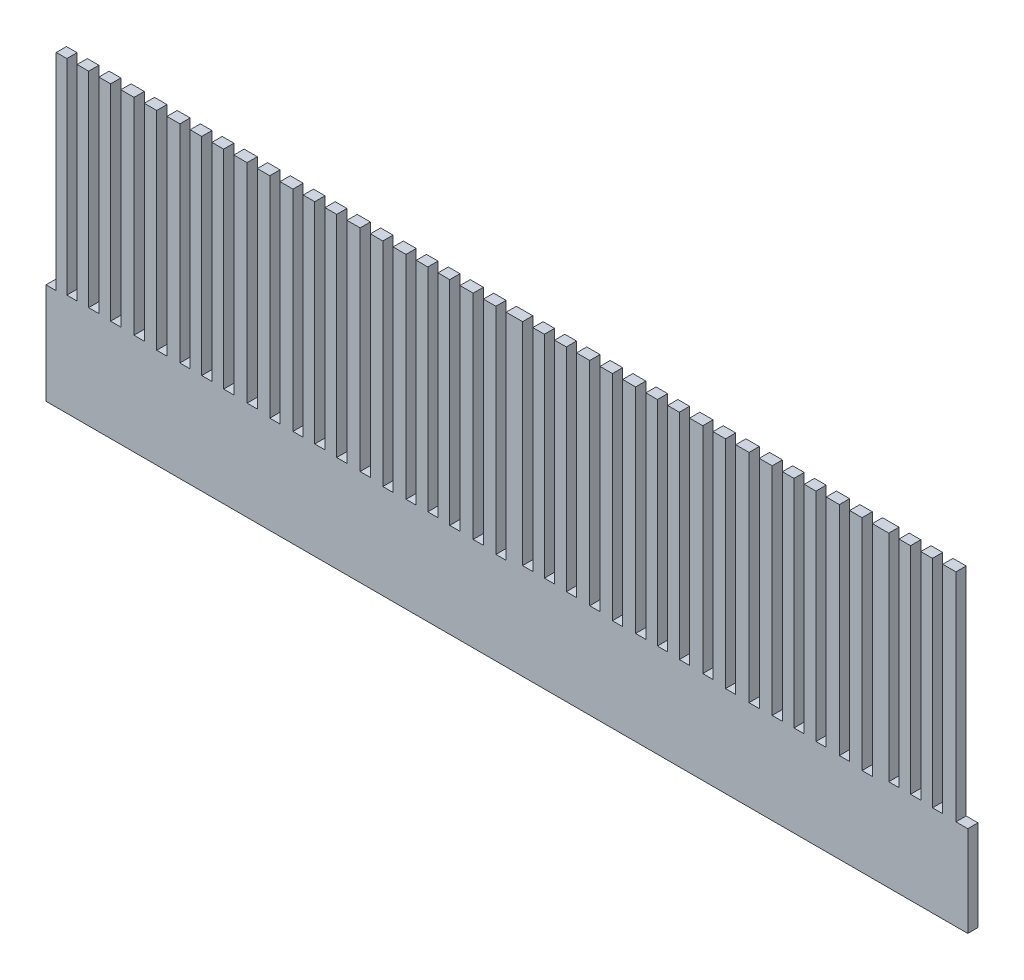
from build123d import *

# Parameters (mm, degrees)
SKETCH1_W           = 45
SKETCH1_H           = 15
BOSS_EXTRUDE1_DEPTH = 0.5
SKETCH2_W           = 0.5
SKETCH2_H           = 12
SKETCH2_H_2         = 10.074487737
SKETCH2_W_2         = 0.812235623
CUT_EXTRUDE1_DEPTH  = 0.5


with BuildPart() as part:
    # Sketch1 → Boss-Extrude1 (new body)
    with BuildSketch(Plane.XY):
        with Locations((-31.419252999, 7.5)):
            Rectangle(SKETCH1_W, SKETCH1_H)
    extrude(amount=BOSS_EXTRUDE1_DEPTH)

    # Sketch2 → Cut-Extrude1 (cut)
    with BuildSketch(Plane.XY.offset(0.5)):
        with Locations((-52.65136316, 10.998562855)):
            Rectangle(SKETCH2_W, SKETCH2_H)
        with Locations((-53.669252999, 9.962756132)):
            Rectangle(SKETCH2_W, SKETCH2_H_2)
        with Locations((-51.587300045, 11.000260257)):
            Rectangle(SKETCH2_W, SKETCH2_H)
        with Locations((-50.51602115, 10.963702729)):
            Rectangle(SKETCH2_W, SKETCH2_H)
        with Locations((-49.371583394, 10.941885768)):
            Rectangle(SKETCH2_W, SKETCH2_H)
        with Locations((-48.263902197, 10.86130862)):
            Rectangle(SKETCH2_W, SKETCH2_H)
        with Locations((-47.132506134, 10.88799725)):
            Rectangle(SKETCH2_W, SKETCH2_H)
        with Locations((-46.068443018, 10.889694652)):
            Rectangle(SKETCH2_W, SKETCH2_H)
        with Locations((-44.997164124, 10.853137125)):
            Rectangle(SKETCH2_W, SKETCH2_H)
        with Locations((-43.852726367, 10.831320164)):
            Rectangle(SKETCH2_W, SKETCH2_H)
        with Locations((-42.745045171, 10.750743016)):
            Rectangle(SKETCH2_W, SKETCH2_H)
        with Locations((-41.613016052, 10.755156249)):
            Rectangle(SKETCH2_W, SKETCH2_H)
        with Locations((-40.548952936, 10.756853651)):
            Rectangle(SKETCH2_W, SKETCH2_H)
        with Locations((-39.477674042, 10.720296123)):
            Rectangle(SKETCH2_W, SKETCH2_H)
        with Locations((-38.333236285, 10.698479162)):
            Rectangle(SKETCH2_W, SKETCH2_H)
        with Locations((-37.225555089, 10.617902014)):
            Rectangle(SKETCH2_W, SKETCH2_H)
        with Locations((-36.094159026, 10.644590644)):
            Rectangle(SKETCH2_W, SKETCH2_H)
        with Locations((-35.03009591, 10.646288046)):
            Rectangle(SKETCH2_W, SKETCH2_H)
        with Locations((-33.958817016, 10.609730519)):
            Rectangle(SKETCH2_W, SKETCH2_H)
        with Locations((-32.814379259, 10.587913558)):
            Rectangle(SKETCH2_W, SKETCH2_H)
        with Locations((-31.706698063, 10.50733641)):
            Rectangle(SKETCH2_W, SKETCH2_H)
        with Locations((-30.403756477, 10.686250193)):
            Rectangle(SKETCH2_W, SKETCH2_H)
        with Locations((-29.339693362, 10.687947595)):
            Rectangle(SKETCH2_W, SKETCH2_H)
        with Locations((-28.268414467, 10.651390067)):
            Rectangle(SKETCH2_W, SKETCH2_H)
        with Locations((-27.123976711, 10.629573106)):
            Rectangle(SKETCH2_W, SKETCH2_H)
        with Locations((-26.016295514, 10.548995958)):
            Rectangle(SKETCH2_W, SKETCH2_H)
        with Locations((-24.884899451, 10.575684588)):
            Rectangle(SKETCH2_W, SKETCH2_H)
        with Locations((-23.820836336, 10.57738199)):
            Rectangle(SKETCH2_W, SKETCH2_H)
        with Locations((-22.749557441, 10.540824462)):
            Rectangle(SKETCH2_W, SKETCH2_H)
        with Locations((-21.605119685, 10.519007501)):
            Rectangle(SKETCH2_W, SKETCH2_H)
        with Locations((-20.497438488, 10.438430353)):
            Rectangle(SKETCH2_W, SKETCH2_H)
        with Locations((-19.347892241, 10.418530687)):
            Rectangle(SKETCH2_W, SKETCH2_H)
        with Locations((-18.216496178, 10.445219317)):
            Rectangle(SKETCH2_W, SKETCH2_H)
        with Locations((-17.152433063, 10.446916719)):
            Rectangle(SKETCH2_W, SKETCH2_H)
        with Locations((-16.081154168, 10.410359191)):
            Rectangle(SKETCH2_W, SKETCH2_H)
        with Locations((-14.936716412, 10.38854223)):
            Rectangle(SKETCH2_W, SKETCH2_H)
        with Locations((-13.829035215, 10.307965082)):
            Rectangle(SKETCH2_W, SKETCH2_H)
        with Locations((-12.526093629, 10.486878866)):
            Rectangle(SKETCH2_W, SKETCH2_H)
        with Locations((-11.462030514, 10.488576268)):
            Rectangle(SKETCH2_W, SKETCH2_H)
        with Locations((-10.390751619, 10.45201874)):
            Rectangle(SKETCH2_W, SKETCH2_H)
        with Locations((-9.090196052, 10.430201779)):
            Rectangle(SKETCH2_W_2, SKETCH2_H)
        with Locations((-8.138632666, 10.349624631)):
            Rectangle(SKETCH2_W, SKETCH2_H)
        with Locations((-7.007236603, 10.376313261)):
            Rectangle(SKETCH2_W, SKETCH2_H)
        with Locations((-5.943173488, 10.378010663)):
            Rectangle(SKETCH2_W, SKETCH2_H)
        with Locations((-4.871894593, 10.341453135)):
            Rectangle(SKETCH2_W, SKETCH2_H)
        with Locations((-3.727456837, 10.319636174)):
            Rectangle(SKETCH2_W, SKETCH2_H)
        with Locations((-2.61977564, 10.239059026)):
            Rectangle(SKETCH2_W, SKETCH2_H)
    extrude(amount=-CUT_EXTRUDE1_DEPTH, mode=Mode.SUBTRACT)


solid = part.part
